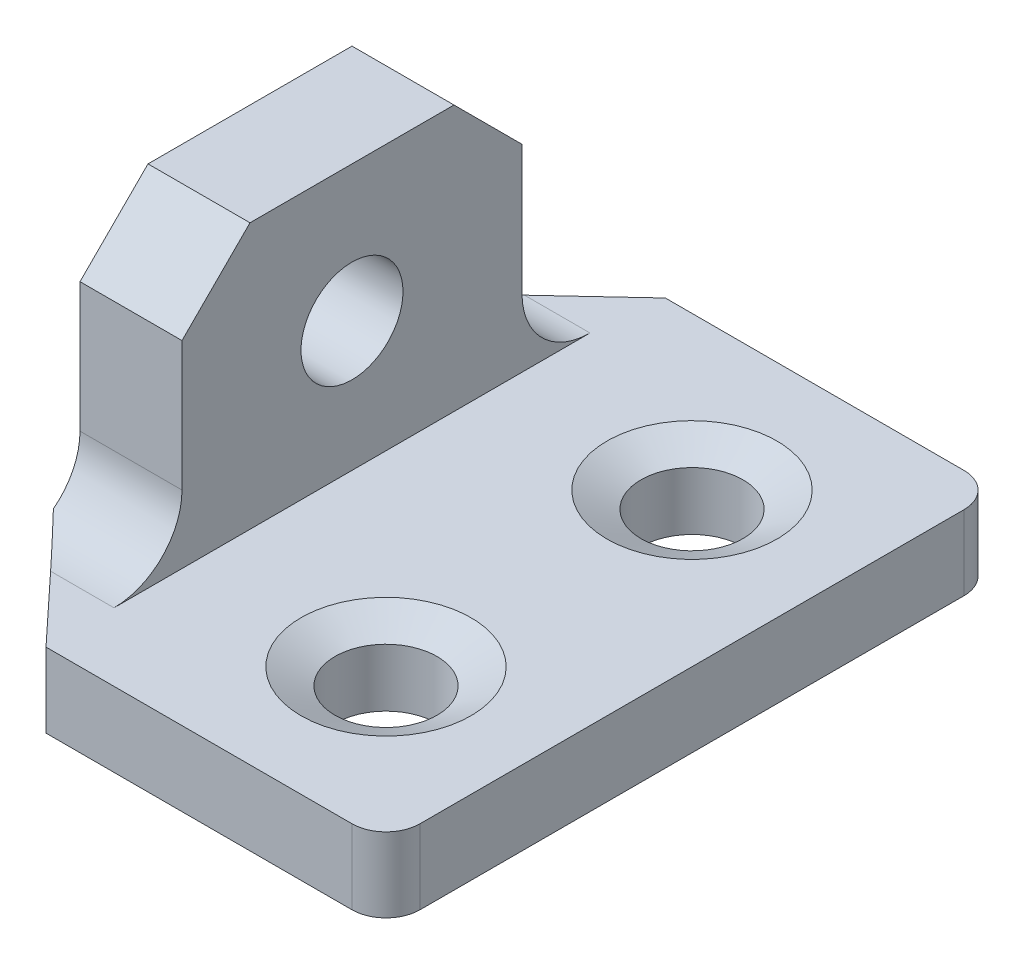
from build123d import *
from OCP.BRepFilletAPI import BRepFilletAPI_MakeChamfer

# Parameters (mm, degrees)
SKETCH1_W                = 70
SKETCH1_H                = 150
BOSS_EXTRUDE1_DEPTH      = 5
SKETCH2_W                = 4
SKETCH2_H                = 15
BOSS_EXTRUDE2_DEPTH      = 15
BOSS_EXTRUDE3_REACH      = 89.321
SKETCH3_R                = 3
CHAMFER1_SIZE            = 4
CHAMFER2_SIZE            = 4
CHAMFER3_SIZE            = 4
CHAMFER4_SIZE            = 10
CHAMFER5_SIZE            = 20
SKETCH4_W                = 3
SKETCH4_H                = 10
BOSS_EXTRUDE4_DEPTH      = 10
CHAMFER6_SIZE            = 2
SKETCH5_R                = 1.5
CUT_EXTRUDE1_DEPTH       = 100.969995499
CUT_EXTRUDE2_DEPTH       = 106
BOSS_EXTRUDE5_DEPTH      = 10
BOSS_EXTRUDE5_DEPTH_BACK = 3
SKETCH7_W                = 18
SKETCH7_H                = 2.192346064
CHAMFER7_SIZE            = 3
CHAMFER7_SIZE2           = 3.21710613
FILLET1_R                = 2
SKETCH8_R                = 1.5
CUT_EXTRUDE3_DEPTH       = 10
CHAMFER8_SIZE            = 1
CHAMFER8_SIZE2           = 0.487732589
FILLET2_R                = 1
SKETCH9_W                = 23.659390011
SKETCH9_H                = 22.018276252
CUT_EXTRUDE4_DEPTH       = 20


with BuildPart() as part:
    # Sketch1 → Boss-Extrude1 (new body)
    with BuildSketch(Plane(origin=(0, 0, 0), x_dir=(1, 0, 0), z_dir=(0, 1, 0))):
        Rectangle(SKETCH1_W, SKETCH1_H)
    extrude(amount=BOSS_EXTRUDE1_DEPTH)

    # Sketch2 → Boss-Extrude2 (add)
    with BuildSketch(Plane(origin=(0, 5, 0), x_dir=(1, 0, 0), z_dir=(0, 1, 0))):
        with Locations((-7, 62.5)):
            Rectangle(SKETCH2_W, SKETCH2_H)
        with Locations((7, 62.5)):
            Rectangle(SKETCH2_W, SKETCH2_H)
    extrude(amount=BOSS_EXTRUDE2_DEPTH)

    # Sketch3 → Boss-Extrude3 (add, up to next)
    with BuildSketch(Plane(origin=(-5, 0, 0), x_dir=(0, 0, -1), z_dir=(1, 0, 0)), mode=Mode.PRIVATE) as boss_extrude3_sk1:
        with Locations(Location((62.5, 12.5, 0), (0, 0, 180))):
            Circle(SKETCH3_R)
    boss_extrude3_tool1 = extrude(boss_extrude3_sk1.sketch, amount=BOSS_EXTRUDE3_REACH, mode=Mode.PRIVATE) - part.part
    add(boss_extrude3_tool1.solids().sort_by_distance((-5, 12.5, -62.5))[0])

    # Chamfer1
    chamfer1_edges = [part.edges().sort_by_distance(p)[0] for p in [
        (-7, 20, -70),
        (-7, 20, -55),
        (7, 20, -70),
        (7, 20, -55),
    ]]
    chamfer(chamfer1_edges, length=CHAMFER1_SIZE)

    # Chamfer2
    chamfer2_edges = [part.edges().sort_by_distance(p)[0] for p in [
        (-7, 5, -70),
        (-7, 5, -55),
        (7, 5, -70),
        (7, 5, -55),
    ]]
    chamfer(chamfer2_edges, length=CHAMFER2_SIZE)

    # Chamfer3
    chamfer3_edges = [part.edges().sort_by_distance(p)[0] for p in [
        (9, 5, -62.5),
        (-9, 5, -62.5),
    ]]
    chamfer(chamfer3_edges, length=CHAMFER3_SIZE)

    # Chamfer4
    chamfer4_edges = [part.edges().sort_by_distance(p)[0] for p in [
        (-35, 2.5, -75),
        (35, 2.5, -75),
    ]]
    chamfer(chamfer4_edges, length=CHAMFER4_SIZE)

    # Chamfer5
    chamfer5_edges = [part.edges().sort_by_distance(p)[0] for p in [
        (35, 2.5, 75),
        (-35, 2.5, 75),
    ]]
    chamfer(chamfer5_edges, length=CHAMFER5_SIZE)

    # Sketch4 → Boss-Extrude4 (add)
    with BuildSketch(Plane(origin=(0, 5, 0), x_dir=(1, 0, 0), z_dir=(0, 1, 0))):
        with Locations((26.5, -25)):
            Rectangle(SKETCH4_W, SKETCH4_H)
        with Locations((-26.5, -25)):
            Rectangle(SKETCH4_W, SKETCH4_H)
    extrude(amount=BOSS_EXTRUDE4_DEPTH)

    # Chamfer6
    chamfer6_edges = [part.edges().sort_by_distance(p)[0] for p in [
        (26.5, 15, 20),
        (26.5, 15, 30),
        (-26.5, 15, 20),
        (-26.5, 15, 30),
    ]]
    chamfer(chamfer6_edges, length=CHAMFER6_SIZE)

    # Sketch5 → Cut-Extrude1 (cut, through all)
    with BuildSketch(Plane(origin=(28, 0, 0), x_dir=(0, 0, -1), z_dir=(1, 0, 0))):
        with Locations((-25, 11)):
            Circle(SKETCH5_R)
    extrude(amount=-CUT_EXTRUDE1_DEPTH, mode=Mode.SUBTRACT)

    # Sketch6 → Cut-Extrude2 (cut)
    with BuildSketch(Plane(origin=(35, 0, 0), x_dir=(0, 0, -1), z_dir=(1, 0, 0))):
        Polygon((-75, 5), (44.602239444, 5), (44.602239444, 35.253881219), (84.386815395, 35.253881219), (84.386815395, 5), (84.386815395, -21.159404211), (-75, -21.159404211), align=None)
    extrude(amount=-CUT_EXTRUDE2_DEPTH, mode=Mode.SUBTRACT)


with BuildPart() as cut_extrude2_piece_1:
    # of the separate pieces the step leaves, piece 1, a body of its own (cut_extrude2_pieces)
    add(part.part.solids().sort_by_distance((-25, 13, 20))[0])

    # Sketch9 → Cut-Extrude4 (cut)
    with BuildSketch(Plane(origin=(0, 0, 16), x_dir=(-1, 0, 0), z_dir=(0, 0, -1))):
        with Locations((24.129769204, 9.145253251)):
            Rectangle(SKETCH9_W, SKETCH9_H)
    extrude(amount=-CUT_EXTRUDE4_DEPTH, mode=Mode.SUBTRACT)


with BuildPart() as cut_extrude2_piece_2:
    # of the separate pieces the step leaves, piece 2, a body of its own (cut_extrude2_pieces)
    add(part.part.solids().sort_by_distance((25, 13, 20))[0])

    # Sketch7 → Boss-Extrude5 (add, two sides: drawn at the far end of the back side and taken through both)
    with BuildSketch(Plane(origin=(28, 0, 0), x_dir=(0, 0, -1), z_dir=(1, 0, 0)).offset(-BOSS_EXTRUDE5_DEPTH_BACK)):
        with Locations((-25, 6.096173032)):
            Rectangle(SKETCH7_W, SKETCH7_H)
    extrude(amount=BOSS_EXTRUDE5_DEPTH + BOSS_EXTRUDE5_DEPTH_BACK)

    # Chamfer7: one chamfer whose edges measure the first distance from different faces: ONE call of the kernel's chamfer builder (chamfer() names one face for all edges)
    chamfer7_edges_1 = [cut_extrude2_piece_2.edges().sort_by_distance(p)[0] for p in [
        (25, 6.096173032, 34),
    ]]
    chamfer7_side_1 = [cut_extrude2_piece_2.faces().sort_by_distance(p)[0] for p in [
        (31.5, 6.096173032, 34),
    ]]
    chamfer7_edges_2 = [cut_extrude2_piece_2.edges().sort_by_distance(p)[0] for p in [
        (25, 6.096173032, 16),
    ]]
    chamfer7_side_2 = [cut_extrude2_piece_2.faces().sort_by_distance(p)[0] for p in [
        (25, 9.127734828, 25),
    ]]
    chamfer7 = BRepFilletAPI_MakeChamfer(cut_extrude2_piece_2.part.solid().wrapped)
    for e in chamfer7_edges_1:
        chamfer7.Add(CHAMFER7_SIZE, CHAMFER7_SIZE2, e.wrapped, chamfer7_side_1[0].wrapped)  # the first distance lies on this face
    for e in chamfer7_edges_2:
        chamfer7.Add(CHAMFER7_SIZE, CHAMFER7_SIZE2, e.wrapped, chamfer7_side_2[0].wrapped)  # the first distance lies on this face
    add(Compound.cast(chamfer7.Shape()), mode=Mode.REPLACE)

    # Fillet1
    fillet1_edges = [cut_extrude2_piece_2.edges().sort_by_distance(p)[0] for p in [
        (26.5, 7.192346064, 30),
        (26.5, 7.192346064, 20),
    ]]
    fillet(fillet1_edges, radius=FILLET1_R)

    # Sketch8 → Cut-Extrude3 (cut)
    with BuildSketch(Plane(origin=(0, 7.192346064, 0), x_dir=(1, 0, 0), z_dir=(0, 1, 0))):
        with Locations(Location((33.5, -20.5, 0), (0, 0, 270))):
            Circle(SKETCH8_R)
        with Locations(Location((33.5, -29.5, 0), (0, 0, 270))):
            Circle(SKETCH8_R)
    extrude(amount=-CUT_EXTRUDE3_DEPTH, mode=Mode.SUBTRACT)

    # Chamfer8
    chamfer8_edges = [cut_extrude2_piece_2.edges().sort_by_distance(p)[0] for p in [
        (33.5, 7.192346064, 19),
        (33.5, 7.192346064, 28),
    ]]
    chamfer8_side = [cut_extrude2_piece_2.faces().sort_by_distance(p)[0] for p in [
        (32.839348065, 7.192346064, 25.007845187),
    ]]
    chamfer(chamfer8_edges, length=CHAMFER8_SIZE, length2=CHAMFER8_SIZE2, reference=chamfer8_side[0])

    # Fillet2
    fillet2_edges = [cut_extrude2_piece_2.edges().sort_by_distance(p)[0] for p in [
        (38, 6.096173032, 34),
        (38, 6.096173032, 16),
    ]]
    fillet(fillet2_edges, radius=FILLET2_R)


solid = cut_extrude2_piece_2.part
